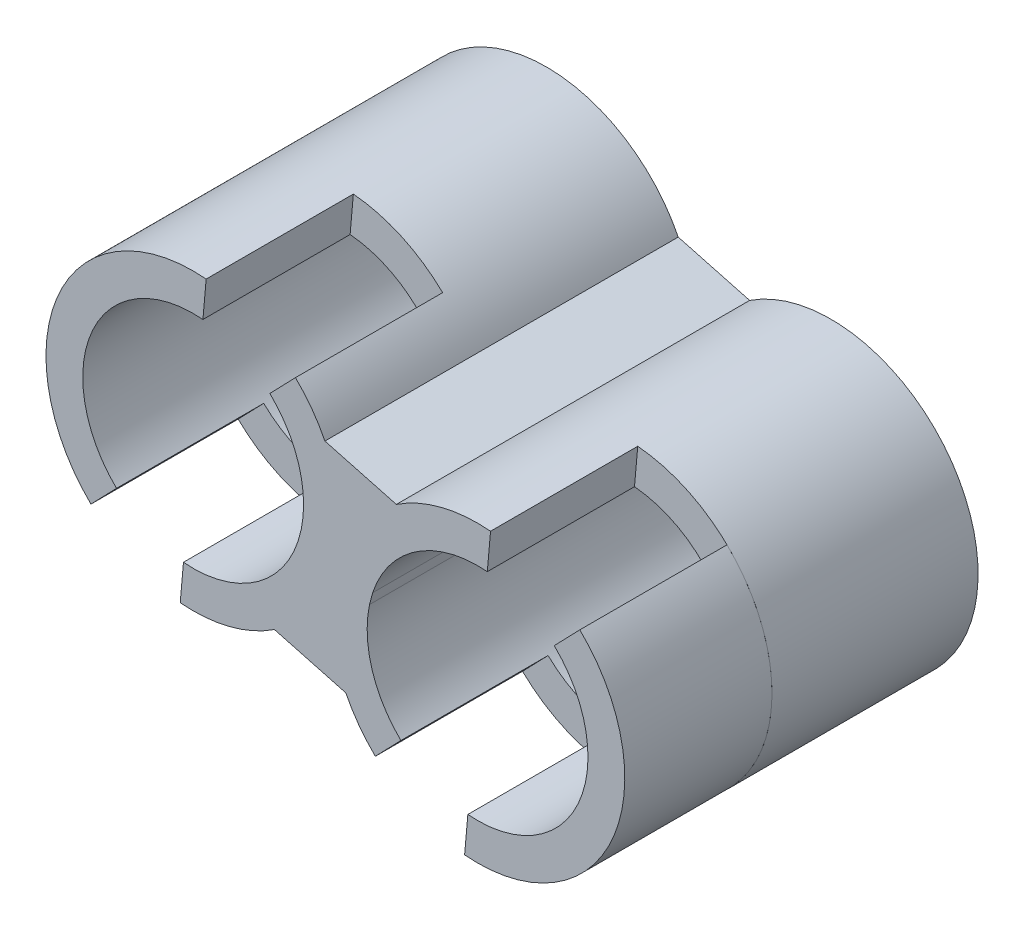
from build123d import *
from build123d.topology import SkipClean

# Parameters (mm, degrees)
SKETCH1_R             = 7.5
SKETCH1_R_2           = 3.285
BOSS_EXTRUDE1_DEPTH   = 2
BOSS_EXTRUDE1_2_DEPTH = 2
SKETCH1_3_R           = 10
SKETCH1_3_R_2         = 7.5
BOSS_EXTRUDE2_DEPTH   = 14
BOSS_EXTRUDE3_DEPTH   = 10
BOSS_EXTRUDE4_DEPTH   = 24


with BuildPart() as part:
    # Sketch1 → Boss-Extrude1 (new body)
    with BuildSketch(Plane.XY):
        Circle(SKETCH1_R)
        Circle(SKETCH1_R_2, mode=Mode.SUBTRACT)
    extrude(amount=BOSS_EXTRUDE1_DEPTH)

    # Sketch1<3> → Boss-Extrude2 (add)
    # profile 1 of 2: a face of its own
    with BuildSketch(Plane.XY):
        Circle(SKETCH1_3_R)
        Circle(SKETCH1_3_R_2, mode=Mode.SUBTRACT)
    # profile 2 of 2: a face of its own
    with BuildSketch(Plane.XY):
        with Locations((19.318516526, -5.176380902)):
            Circle(SKETCH1_3_R)
        with Locations((19.318516526, -5.176380902)):
            Circle(SKETCH1_3_R_2, mode=Mode.SUBTRACT)
    extrude(amount=BOSS_EXTRUDE2_DEPTH)


with BuildPart() as body_2:
    # Sketch1 → Boss-Extrude1 2 (new body)
    with BuildSketch(Plane.XY):
        with Locations((19.318516526, -5.176380902)):
            Circle(SKETCH1_R)
        with Locations((19.318516526, -5.176380902)):
            Circle(SKETCH1_R_2, mode=Mode.SUBTRACT)
    extrude(amount=BOSS_EXTRUDE1_2_DEPTH)



with BuildPart() as boss_extrude2_piece_1:
    # of the separate pieces the step leaves, piece 1, a body of its own (boss_extrude2_pieces)
    add(part.part.solids().sort_by_distance((3.285, 0, 0))[0])

    # Sketch2 → Boss-Extrude3 (add)
    with SkipClean():  # the faces are left unmerged after this step: merging them gives an invalid solid
        with BuildSketch(Plane.XY.offset(14)):
            with BuildLine():
                ThreePointArc((0.880723614, 9.961140794), (-9.097879067, 4.150734451), (-6.945976325, -7.193984493))
                Line((-6.945976325, -7.193984493), (-5.209482244, -5.39548837))
                ThreePointArc((-5.209482244, -5.39548837), (-6.8234093, 3.113050838), (0.66054271, 7.470855595))
                Line((0.66054271, 7.470855595), (0.880723614, 9.961140794))
            make_face()
            with BuildLine():
                ThreePointArc((20.199240139, 4.784759892), (13.586521544, 3.017777598), (9.659258283, -2.588190376))
                ThreePointArc((9.659258283, -2.588190376), (9.68232481, -7.849171431), (12.372540201, -12.370365396))
                Line((12.372540201, -12.370365396), (14.109034282, -10.571869272))
                ThreePointArc((14.109034282, -10.571869272), (12.495107225, -2.063330064), (19.979059236, 2.294474693))
                Line((19.979059236, 2.294474693), (20.199240139, 4.784759892))
            make_face()
            with BuildLine():
                Line((-0.66054271, -7.470855595), (-0.880723614, -9.961140794))
                ThreePointArc((-0.880723614, -9.961140794), (5.731995045, -8.194158456), (9.659258283, -2.588190376))
                ThreePointArc((9.659258283, -2.588190376), (9.636191695, 2.672790603), (6.945976325, 7.193984493))
                Line((6.945976325, 7.193984493), (5.209482244, 5.39548837))
                ThreePointArc((5.209482244, 5.39548837), (6.8234093, -3.113050838), (-0.66054271, -7.470855595))
            make_face()
            with BuildLine():
                ThreePointArc((18.437792912, -15.137521696), (28.416395593, -9.327115353), (26.264492851, 2.017603591))
                Line((26.264492851, 2.017603591), (24.52799877, 0.219107468))
                ThreePointArc((24.52799877, 0.219107468), (26.141925826, -8.28943174), (18.657973816, -12.647236497))
                Line((18.657973816, -12.647236497), (18.437792912, -15.137521696))
            make_face()
        extrude(amount=BOSS_EXTRUDE3_DEPTH)


with BuildPart() as boss_extrude2_piece_2:
    # of the separate pieces the step leaves, piece 2, a body of its own (boss_extrude2_pieces)
    add(part.part.solids().sort_by_distance((29.318516526, -5.176380902, 0))[0])


with BuildPart() as boss_extrude3_piece_1:
    # of the separate pieces the step leaves, piece 1, a body of its own (boss_extrude3_pieces)
    add(boss_extrude2_piece_1.part.solids().sort_by_distance((3.285, 0, 0))[0])


with BuildPart() as boss_extrude3_piece_2:
    # of the separate pieces the step leaves, piece 2, a body of its own (boss_extrude3_pieces)
    add(boss_extrude2_piece_1.part.solids().sort_by_distance((26.264492851, 2.017603591, 14))[0])


with BuildPart() as boss_extrude3_piece_3:
    # of the separate pieces the step leaves, piece 3, a body of its own (boss_extrude3_pieces)
    add(boss_extrude2_piece_1.part.solids().sort_by_distance((20.199240139, 4.784759892, 14))[0])


with BuildPart() as body_2_1:
    with SkipClean():  # the faces are left unmerged after this step: merging them gives an invalid solid
        add(body_2.part)

        add(boss_extrude2_piece_2.part)  # Boss-Extrude4 merges Boss-Extrude2 piece 2

        add(boss_extrude3_piece_1.part)  # Boss-Extrude4 merges Boss-Extrude3 piece 1

        add(boss_extrude3_piece_3.part)  # Boss-Extrude4 merges Boss-Extrude3 piece 3
        # Sketch4 → Boss-Extrude4 (add)
        with BuildSketch(Plane.XY.offset(24)):
            Polygon((13.800709497, 3.163511519), (8.948507271, 4.463655187), (5.517807029, -8.339892421), (10.370009255, -9.640036089), align=None)
        extrude(amount=-BOSS_EXTRUDE4_DEPTH)


solid = Compound([boss_extrude3_piece_2.part, body_2_1.part])
